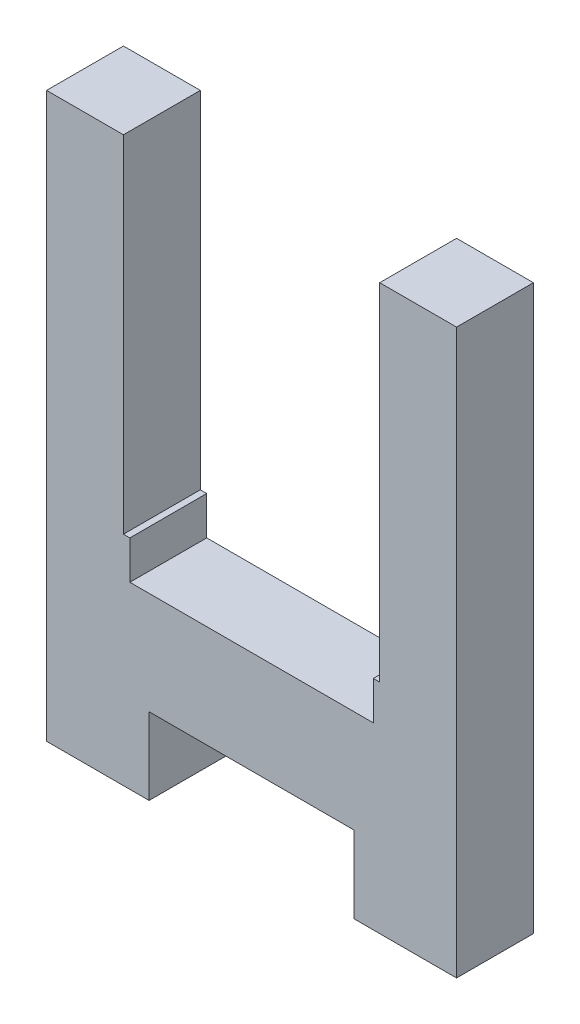
from build123d import *

# Parameters (mm, degrees)
BOSS_EXTRU_1_DEPTH = 6


with BuildPart() as part:
    # Esquisse1 → Boss.-Extru.1 (new body)
    with BuildSketch(Plane.XY):
        Polygon((0, 0), (0, 44), (-6, 44), (-6, 17), (-6.5, 17), (-6.5, 14), (-25.5, 14), (-25.5, 17), (-26, 17), (-26, 44), (-32, 44), (-32, 0), (-24, 0), (-24, 6), (-8, 6), (-8, 0), align=None)
    extrude(amount=BOSS_EXTRU_1_DEPTH)


solid = part.part
